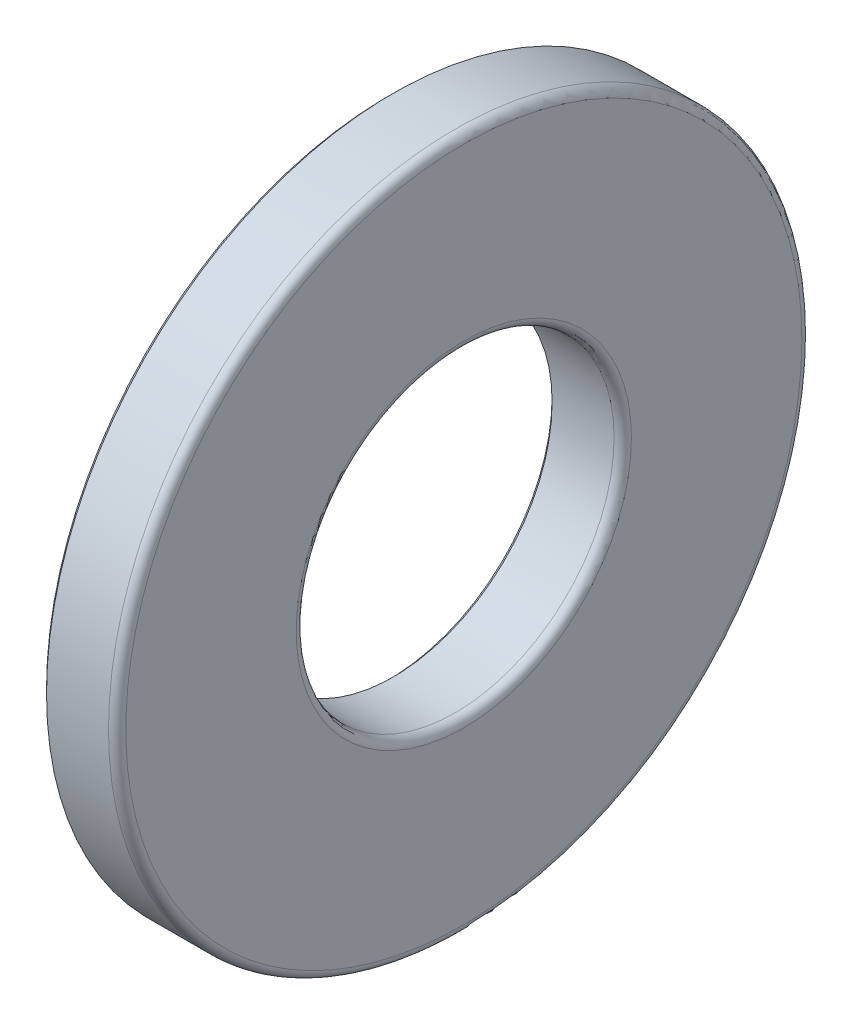
from build123d import *

# Parameters (mm, degrees)
CHAMFER_1_SIZE = 0.15


with BuildPart() as part:
    # Эскиз1 → Повернуть1 (revolve)
    with BuildSketch(Plane.XY, mode=Mode.PRIVATE) as revolve_1_sk:
        with BuildLine():
            Line((6.4048, 12), (6.4048, 9.9286))
            ThreePointArc((6.4048, 9.9286), (6.881, 8.5), (6.4048, 7.0714))
            Line((6.4048, 7.0714), (6.4048, 5.5))
            Line((6.4048, 5.5), (8.7, 5.5))
            ThreePointArc((8.7, 5.5), (8.912132034, 5.587867966), (9, 5.8))
            Line((9, 5.8), (9, 11.7))
            ThreePointArc((9, 11.7), (8.912132034, 11.912132034), (8.7, 12))
            Line((8.7, 12), (6.4048, 12))
        make_face()
    revolve(revolve_1_sk.sketch.rotate(Axis((6.4048, 0, 0), (1, 0, 0)), 270), axis=Axis((6.4048, 0, 0), (1, 0, 0)))

    # Фаска1
    chamfer_1_edges = [part.edges().sort_by_distance(p)[0] for p in [
        (6.4048, 0, 12),
        (6.4048, 0, 5.5),
    ]]
    chamfer(chamfer_1_edges, length=CHAMFER_1_SIZE)


solid = part.part
